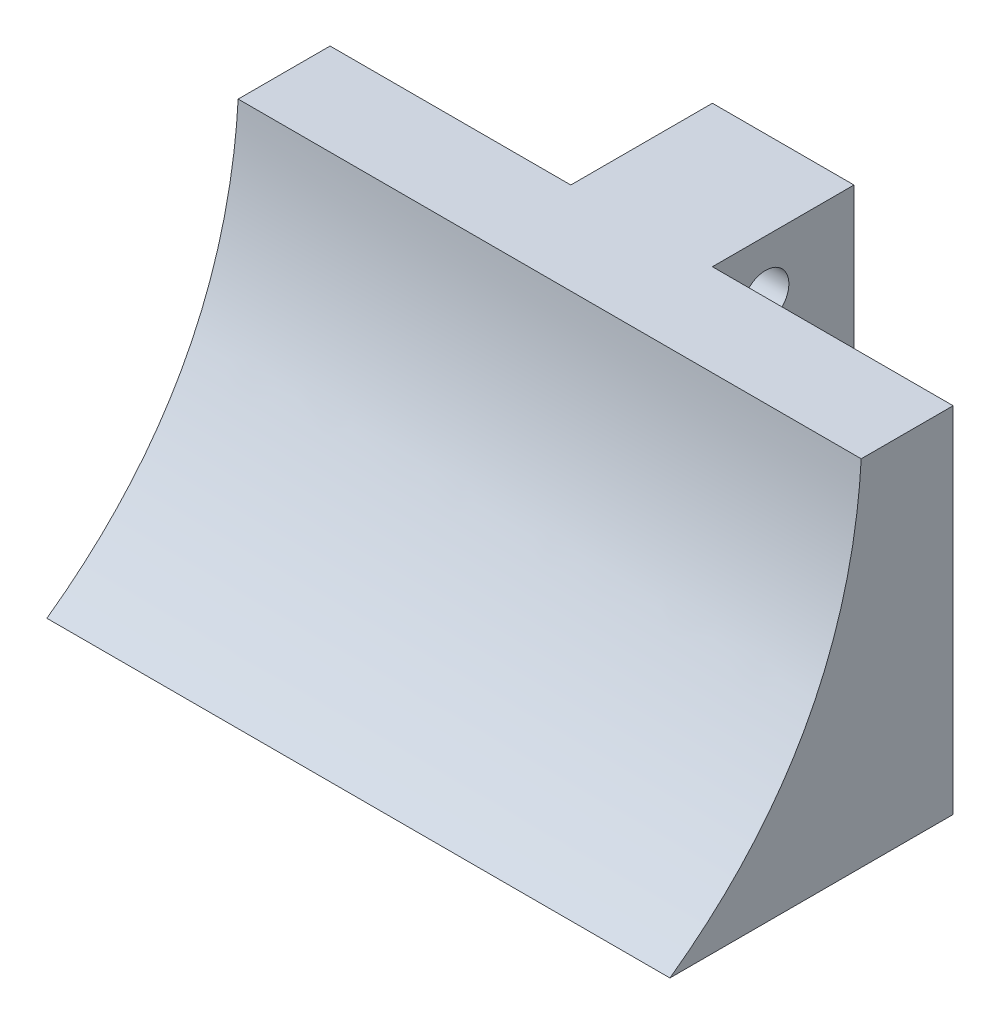
from build123d import *

# Parameters (mm, degrees)
BOSS_EXTRUDE1_DEPTH = 50
SKETCH2_W           = 20
SKETCH2_H           = 15
CUT_EXTRUDE1_DEPTH  = 40
CUT_EXTRUDE2_DEPTH  = 134
CUT_EXTRUDE3_REACH  = 85.762
SKETCH5_R           = 3.3


with BuildPart() as part:
    # Sketch1 → Boss-Extrude1 (new body)
    with BuildSketch(Plane(origin=(0, 0, 0), x_dir=(1, 0, 0), z_dir=(0, 1, 0))):
        Polygon((0, 0), (34, 0), (34, 20), (54, 20), (54, 0), (88, 0), (88, -40), (0, -40), align=None)
    extrude(amount=BOSS_EXTRUDE1_DEPTH)

    # Sketch2 → Cut-Extrude1 (cut)
    with BuildSketch(Plane(origin=(54, 0, 0), x_dir=(0, 0, -1), z_dir=(1, 0, 0))):
        with Locations((10, 7.5)):
            Rectangle(SKETCH2_W, SKETCH2_H)
    extrude(amount=-CUT_EXTRUDE1_DEPTH, mode=Mode.SUBTRACT)

    # Sketch3 → Cut-Extrude2 (cut)
    with BuildSketch(Plane(origin=(88, 0, 0), x_dir=(0, 0, -1), z_dir=(1, 0, 0))):
        with BuildLine():
            Line((-40, 0), (-40, 50))
            Line((-40, 50), (-12.980453639, 50))
            add(Edge.make_bspline(
                [(-40, 0), (-14.830140994, 17.978651643), (-12.980453639, 50)],
                knots=[0, 0, 0, 1, 1, 1], degree=2))
        make_face()
    extrude(amount=-CUT_EXTRUDE2_DEPTH, mode=Mode.SUBTRACT)

    # Sketch5 → Cut-Extrude3 (cut, up to next)
    with BuildSketch(Plane(origin=(54, 0, 0), x_dir=(0, 0, -1), z_dir=(1, 0, 0)), mode=Mode.PRIVATE) as cut_extrude3_sk1:
        with Locations((7.5, 42.5)):
            Circle(SKETCH5_R)
    cut_extrude3_tool1 = extrude(cut_extrude3_sk1.sketch, amount=-CUT_EXTRUDE3_REACH, mode=Mode.PRIVATE) & part.part
    # Sketch5 → Cut-Extrude3 (cut, up to next)
    with BuildSketch(Plane(origin=(54, 0, 0), x_dir=(0, 0, -1), z_dir=(1, 0, 0)), mode=Mode.PRIVATE) as cut_extrude3_sk2:
        with Locations((7.5, 27.5)):
            Circle(SKETCH5_R)
    cut_extrude3_tool2 = extrude(cut_extrude3_sk2.sketch, amount=-CUT_EXTRUDE3_REACH, mode=Mode.PRIVATE) & part.part
    add(cut_extrude3_tool1.solids().sort_by_distance((54, 42.5, -7.5))[0], mode=Mode.SUBTRACT)
    add(cut_extrude3_tool2.solids().sort_by_distance((54, 27.5, -7.5))[0], mode=Mode.SUBTRACT)


solid = part.part
